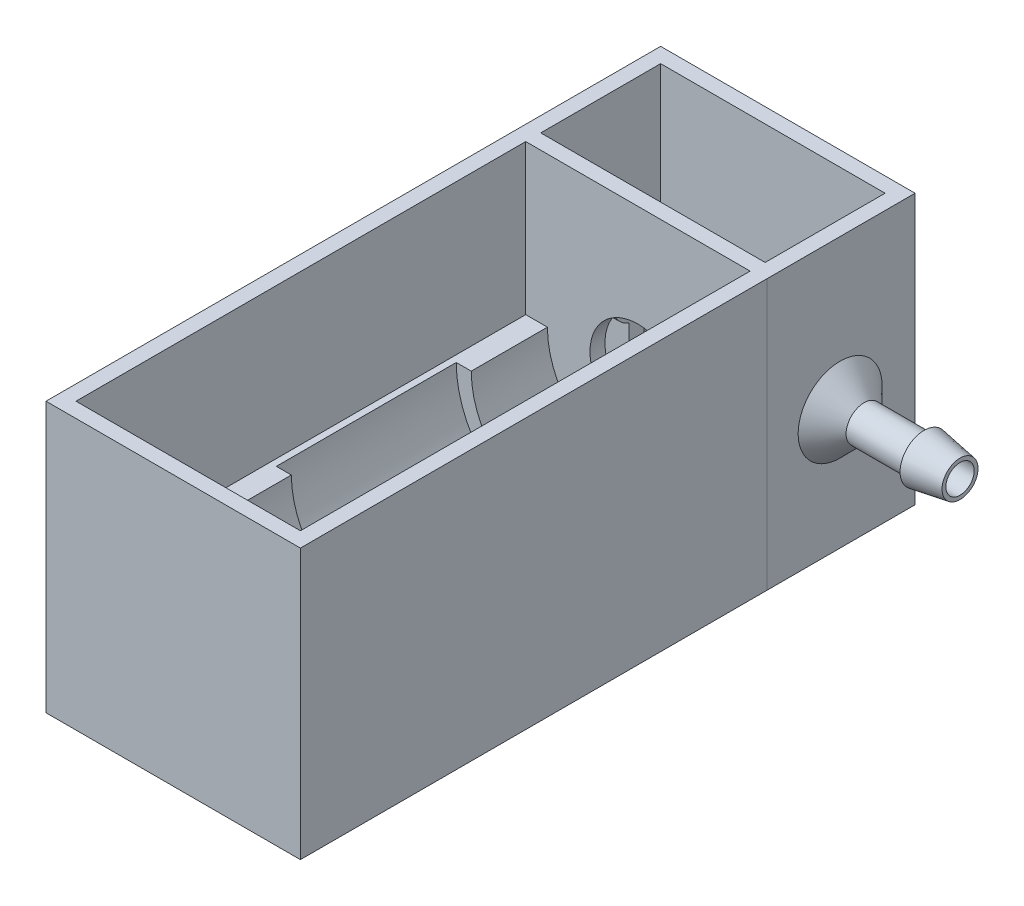
from build123d import *

# Parameters (mm, degrees)
BOSS_EXTRUDE1_DEPTH     = 12.7
SKETCH2_W               = 53.879496
SKETCH2_H               = 57.15
BOSS_EXTRUDE2_DEPTH     = 3.175
CUT_EXTRUDE2_DEPTH      = 80.104913537
CUT_EXTRUDE2_DEPTH_BACK = 80.104913537
SKETCH3_R               = 3
SKETCH5_W               = 53.879496
SKETCH5_H               = 25.4
SKETCH5_R               = 3.4925
BOSS_EXTRUDE3_DEPTH     = 6.35
SKETCH7_W               = 7.62
SKETCH7_H               = 15.609396712
BOSS_EXTRUDE7_DEPTH     = 1.5875
SKETCH8_W               = 53.879496
SKETCH8_H               = 57.15
BOSS_EXTRUDE8_DEPTH     = 101.6
CUT_EXTRUDE7_DEPTH      = 139.094394241
CUT_EXTRUDE7_DEPTH_BACK = 139.094394241
SKETCH13_W              = 0.002356984
SKETCH13_H              = 98.829061331
SKETCH14_W              = 47.527139016
SKETCH14_H              = 95.25
CUT_EXTRUDE8_DEPTH      = 31.75
CUT_EXTRUDE9_DEPTH      = 4.229066359
SKETCH16_W              = 53.879496
SKETCH16_H              = 25.4
CUT_EXTRUDE10_DEPTH     = 136.589746001


with BuildPart() as part:
    # Sketch1 → Boss-Extrude1 (new, symmetric)
    with BuildSketch(Plane.XY):
        Polygon((-26.939748, 0), (26.939748, 0), (26.939748, 6.35), (26.939748, 57.15), (23.764748, 57.15), (23.764748, 6.35), (-23.764748, 6.35), (-23.764748, 57.15), (-26.939748, 57.15), (-26.939748, 6.35), align=None)
    extrude(amount=BOSS_EXTRUDE1_DEPTH, both=True)

    # Sketch2 → Boss-Extrude2 (add)
    with BuildSketch(Plane(origin=(0, 0, -12.7), x_dir=(-1, 0, 0), z_dir=(0, 0, -1))):
        with Locations((0, 28.575)):
            Rectangle(SKETCH2_W, SKETCH2_H)
    extrude(amount=BOSS_EXTRUDE2_DEPTH)

    # Sketch6 → Revolve2 (revolve)
    with BuildSketch(Plane.XY, mode=Mode.PRIVATE) as revolve2_sk:
        Polygon((-23.764748, 25.4), (-16.144748, 25.4), (-16.144748, 30.48), (-21.224748, 30.48), (-23.764748, 33.02), align=None)
        Polygon((23.764748, 33.02), (23.764748, 25.4), (16.144748, 25.4), (16.144748, 30.48), (21.224748, 30.48), align=None)
    revolve(revolve2_sk.sketch.rotate(Axis((-23.764748, 25.4, 0), (1, 0, 0)), 90), axis=Axis((-23.764748, 25.4, 0), (1, 0, 0)))


with BuildPart() as body_2:
    # Sketch4 → Revolve1 (revolve)
    with BuildSketch(Plane.XY, mode=Mode.PRIVATE) as revolve1_sk:
        Polygon((-32.019748, 29.21), (-26.939748, 34.29), (-26.939748, 29.21), (-26.939748, 26.924), (-26.939748, 25.4), (-52.339748, 25.4), (-52.339748, 26.924), (-52.339748, 29.21), (-44.719748, 30.48), (-44.719748, 29.21), align=None)
        Polygon((26.939748, 34.29), (26.939748, 29.21), (26.939748, 26.924), (26.939748, 25.4), (52.339748, 25.4), (52.339748, 26.924), (52.339748, 29.21), (44.719748, 30.48), (44.719748, 29.21), (32.019748, 29.21), align=None)
    revolve(revolve1_sk.sketch.rotate(Axis((25.4, 25.4, 0), (1, 0, 0)), 90), axis=Axis((25.4, 25.4, 0), (1, 0, 0)))


with BuildPart() as cut_extrude2_tool:
    # Sketch3 → Cut-Extrude2 (new, two sides: drawn at the far end of the back side and taken through both)
    with BuildSketch(Plane(origin=(0, 0, 0), x_dir=(0, 0, -1), z_dir=(1, 0, 0)).offset(-CUT_EXTRUDE2_DEPTH_BACK)):
        with Locations((0, 25.4)):
            Circle(SKETCH3_R)
    extrude(amount=CUT_EXTRUDE2_DEPTH + CUT_EXTRUDE2_DEPTH_BACK)


with BuildPart() as part_1:
    add(part.part)

    # Cut-Extrude2: cut by cut_extrude2_tool
    add(cut_extrude2_tool.part, mode=Mode.SUBTRACT)

    # Sketch5 → Boss-Extrude3 (add)
    with BuildSketch(Plane.XZ):
        with Locations((0, -28.575)):
            Rectangle(SKETCH5_W, SKETCH5_H)
        with Locations(Location((7.889748, -28.575, 0), (0, 0, 270))):
            Circle(SKETCH5_R, mode=Mode.SUBTRACT)
        with Locations(Location((-17.510252, -28.575, 0), (0, 0, 270))):
            Circle(SKETCH5_R, mode=Mode.SUBTRACT)
    extrude(amount=-BOSS_EXTRUDE3_DEPTH)

    # Sketch7 → Boss-Extrude7 (add, symmetric)
    with BuildSketch(Plane.XY):
        with Locations((-19.954748, 14.154698356)):
            Rectangle(SKETCH7_W, SKETCH7_H)
        with Locations((19.954748, 14.154698356)):
            Rectangle(SKETCH7_W, SKETCH7_H)
    extrude(amount=BOSS_EXTRUDE7_DEPTH, both=True)

    # Sketch8 → Boss-Extrude8 (add)
    with BuildSketch(Plane.XY.offset(12.7)):
        with Locations((0, 28.575)):
            Rectangle(SKETCH8_W, SKETCH8_H)
    extrude(amount=BOSS_EXTRUDE8_DEPTH)

    # Sketch9 → Cut-Revolve1 (revolve, cut)
    with BuildSketch(Plane(origin=(0, 0, 0), x_dir=(0, 0, -1), z_dir=(1, 0, 0))):
        Polygon((-70.104, 47.752), (-70.104, 44.577), (-107.890879501, 44.577), (-107.890879501, 25.4), (-70.104, 25.4), (0, 25.4), (0, 35.56), (-20.104066359, 35.56), (-20.104066359, 44.577), (-32.004, 44.577), (-32.004, 47.752), align=None)
    revolve(axis=Axis((0, 25.4, 0), (0, 0, 1)), mode=Mode.SUBTRACT)

    # Sketch13 → Cut-Extrude7 (cut, two sides: drawn at the far end of the back side and taken through both)
    with BuildSketch(Plane(origin=(0, 0, 0), x_dir=(-1, 0, 0), z_dir=(0, -1, 0)).offset(-CUT_EXTRUDE7_DEPTH_BACK)):
        with Locations((26.940926492, -64.885469335)):
            Rectangle(SKETCH13_W, SKETCH13_H)
        with Locations((-26.938569508, -64.885469335)):
            Rectangle(SKETCH13_W, SKETCH13_H)
    extrude(amount=CUT_EXTRUDE7_DEPTH + CUT_EXTRUDE7_DEPTH_BACK, mode=Mode.SUBTRACT)

    # Sketch14 → Cut-Extrude8 (cut)
    with BuildSketch(Plane(origin=(0, 57.15, 0), x_dir=(1, 0, 0), z_dir=(0, 1, 0))):
        with Locations((-0.001178492, -63.5)):
            Rectangle(SKETCH14_W, SKETCH14_H)
    extrude(amount=-CUT_EXTRUDE8_DEPTH, mode=Mode.SUBTRACT)

    # Sketch15 → Cut-Extrude9 (cut)
    with BuildSketch(Plane.XY.offset(20.104066359)):
        with BuildLine():
            Line((-10.16, 25.4), (-19.177, 25.4))
            ThreePointArc((-19.177, 25.4), (0, 6.223), (19.177, 25.4))
            Line((19.177, 25.4), (10.16, 25.4))
            ThreePointArc((10.16, 25.4), (0, 15.24), (-10.16, 25.4))
        make_face()
    extrude(amount=-CUT_EXTRUDE9_DEPTH, mode=Mode.SUBTRACT)

    # Sketch16 → Cut-Extrude10 (cut, through all)
    with BuildSketch(Plane(origin=(0, 6.35, 0), x_dir=(1, 0, 0), z_dir=(0, 1, 0))):
        with Locations((0, 28.575)):
            Rectangle(SKETCH16_W, SKETCH16_H)
    extrude(amount=-CUT_EXTRUDE10_DEPTH, mode=Mode.SUBTRACT)


with BuildPart() as body_2_1:
    add(body_2.part)

    # Cut-Extrude2: cut by cut_extrude2_tool
    add(cut_extrude2_tool.part, mode=Mode.SUBTRACT)


solid = Compound([part_1.part, body_2_1.part])
